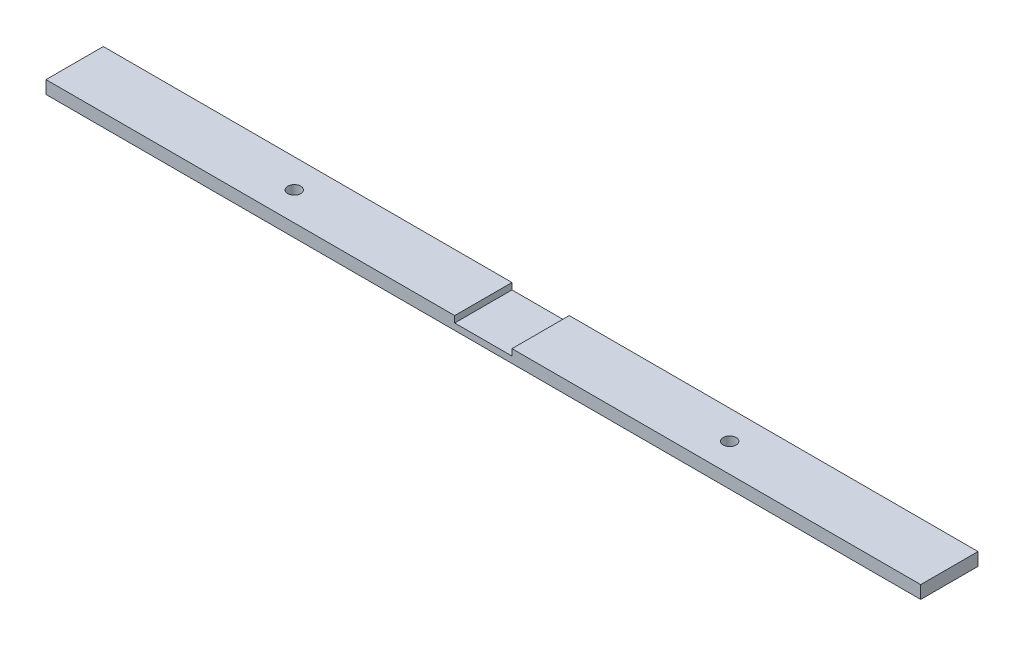
from build123d import *

# Parameters (mm, degrees)
SKETCH1_W               = 229
SKETCH1_H               = 15
BOSS_EXTRUDE1_DEPTH     = 3.375
M3_CLEARANCE_HOLE1_D    = 3.4
CUT_EXTRUDE1_DEPTH      = 116.527661731
CUT_EXTRUDE1_DEPTH_BACK = 116.527661731
SKETCH10_W              = 15
SKETCH10_H              = 1.6875


with BuildPart() as part:
    # Sketch1 → Boss-Extrude1 (new body)
    with BuildSketch(Plane(origin=(0, 0, 0), x_dir=(1, 0, 0), z_dir=(0, 1, 0))):
        Rectangle(SKETCH1_W, SKETCH1_H)
    extrude(amount=BOSS_EXTRUDE1_DEPTH)

    # M3 Clearance Hole1 (through all)
    with Locations(Plane(origin=(0, 0, 0), x_dir=(-1, 0, 0), z_dir=(0, -1, 0))):
        with Locations((57, 0), (-57, 0)):
            Hole(M3_CLEARANCE_HOLE1_D / 2)

    # Sketch10 → Cut-Extrude1 (cut, two sides: drawn at the far end of the back side and taken through both)
    with BuildSketch(Plane.XY.offset(7.5).offset(-CUT_EXTRUDE1_DEPTH_BACK)):
        with Locations((0, 2.53125)):
            Rectangle(SKETCH10_W, SKETCH10_H)
    extrude(amount=CUT_EXTRUDE1_DEPTH + CUT_EXTRUDE1_DEPTH_BACK, mode=Mode.SUBTRACT)


solid = part.part
